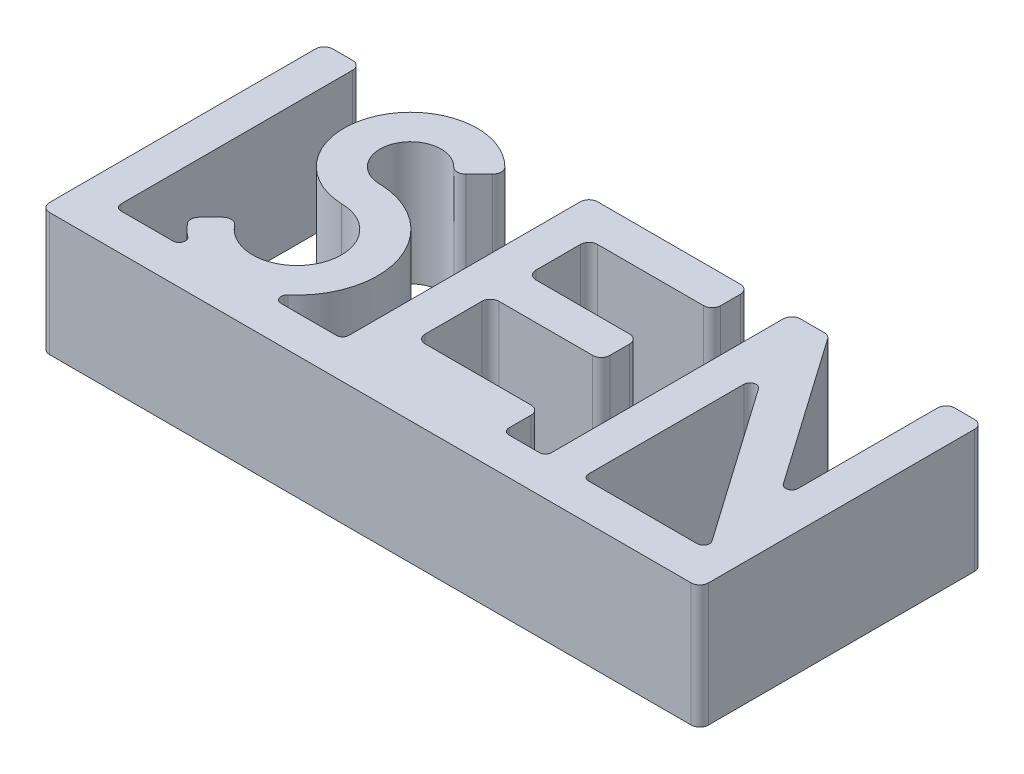
from build123d import *

# Parameters (mm, degrees)
BOSS_EXTRU_1_DEPTH = 10


with BuildPart() as part:
    # Esquisse3 → Boss.-Extru.1 (new body)
    with BuildSketch(Plane(origin=(0, 0, 0), x_dir=(1, 0, 0), z_dir=(0, 1, 0))):
        with BuildLine():
            Line((-82.4, 43.960350299), (-82.4, 24.660350299))
            Line((-82.4, 24.660350299), (-82.4, 22.360350299))
            ThreePointArc((-82.4, 22.360350299), (-82.194974747, 21.865375552), (-81.7, 21.660350299))
            Line((-81.7, 21.660350299), (-29.6, 21.660350299))
            ThreePointArc((-29.6, 21.660350299), (-29.105025253, 21.865375552), (-28.9, 22.360350299))
            Line((-28.9, 22.360350299), (-28.9, 24.660350299))
            Line((-28.9, 24.660350299), (-28.9, 43.960350299))
            ThreePointArc((-28.9, 43.960350299), (-29.105025253, 44.455325045), (-29.6, 44.660350299))
            Line((-29.6, 44.660350299), (-31.2, 44.660350299))
            ThreePointArc((-31.2, 44.660350299), (-31.694974747, 44.455325045), (-31.9, 43.960350299))
            Line((-31.9, 43.960350299), (-31.9, 32.665451753))
            ThreePointArc((-31.9, 32.665451753), (-32.234265531, 32.16295091), (-32.808648392, 32.348220639))
            Line((-32.808648392, 32.348220639), (-41.220684895, 44.361853804))
            ThreePointArc((-41.220684895, 44.361853804), (-41.470867297, 44.581257882), (-41.794091326, 44.660350299))
            Line((-41.794091326, 44.660350299), (-43.729694391, 44.660350299))
            ThreePointArc((-43.729694391, 44.660350299), (-44.224669138, 44.455325045), (-44.429694391, 43.960350299))
            Line((-44.429694391, 43.960350299), (-44.429694391, 25.160350299))
            ThreePointArc((-44.429694391, 25.160350299), (-44.576141, 24.806796908), (-44.929694391, 24.660350299))
            Line((-44.929694391, 24.660350299), (-47.4, 24.660350299))
            ThreePointArc((-47.4, 24.660350299), (-47.753553391, 24.806796908), (-47.9, 25.160350299))
            Line((-47.9, 25.160350299), (-47.9, 26.96406145))
            ThreePointArc((-47.9, 26.96406145), (-48.105025253, 27.459036196), (-48.6, 27.66406145))
            Line((-48.6, 27.66406145), (-57.2, 27.66406145))
            ThreePointArc((-57.2, 27.66406145), (-57.694974747, 27.869086703), (-57.9, 28.36406145))
            Line((-57.9, 28.36406145), (-57.9, 32.960350299))
            ThreePointArc((-57.9, 32.960350299), (-57.694974747, 33.455325045), (-57.2, 33.660350299))
            Line((-57.2, 33.660350299), (-49.6, 33.660350299))
            ThreePointArc((-49.6, 33.660350299), (-49.105025253, 33.865375552), (-48.9, 34.360350299))
            Line((-48.9, 34.360350299), (-48.9, 35.960350299))
            ThreePointArc((-48.9, 35.960350299), (-49.105025253, 36.455325045), (-49.6, 36.660350299))
            Line((-49.6, 36.660350299), (-57.2, 36.660350299))
            ThreePointArc((-57.2, 36.660350299), (-57.694974747, 36.865375552), (-57.9, 37.360350299))
            Line((-57.9, 37.360350299), (-57.9, 40.960350299))
            ThreePointArc((-57.9, 40.960350299), (-57.694974747, 41.455325045), (-57.2, 41.660350299))
            Line((-57.2, 41.660350299), (-48.6, 41.660350299))
            ThreePointArc((-48.6, 41.660350299), (-48.105025253, 41.865375552), (-47.9, 42.360350299))
            Line((-47.9, 42.360350299), (-47.9, 43.960350299))
            ThreePointArc((-47.9, 43.960350299), (-48.105025253, 44.455325045), (-48.6, 44.660350299))
            Line((-48.6, 44.660350299), (-60.2, 44.660350299))
            ThreePointArc((-60.2, 44.660350299), (-60.694974747, 44.455325045), (-60.9, 43.960350299))
            Line((-60.9, 43.960350299), (-60.9, 25.160350299))
            ThreePointArc((-60.9, 25.160350299), (-61.046446609, 24.806796908), (-61.4, 24.660350299))
            Line((-61.4, 24.660350299), (-65.9, 24.660350299))
            ThreePointArc((-65.9, 24.660350299), (-66.369202757, 24.987582324), (-66.224252839, 25.540955207))
            ThreePointArc((-66.224252839, 25.540955207), (-64.278360769, 32.64470583), (-70.174954097, 37.058316142))
            ThreePointArc((-70.174954097, 37.058316142), (-72.565676109, 40.459645131), (-68.487924516, 41.269912109))
            ThreePointArc((-68.487924516, 41.269912109), (-67.991231434, 41.058872606), (-67.492020465, 41.26388504))
            Line((-67.492020465, 41.26388504), (-66.408605494, 42.347300011))
            ThreePointArc((-66.408605494, 42.347300011), (-66.203586079, 42.839415787), (-66.404578845, 43.333189829))
            ThreePointArc((-66.404578845, 43.333189829), (-75.216844977, 41.718134484), (-70.456992958, 34.128124806))
            ThreePointArc((-70.456992958, 34.128124806), (-67.224229351, 28.944517523), (-73.29773035, 28.286390935))
            ThreePointArc((-73.29773035, 28.286390935), (-73.806166505, 28.551332862), (-74.342034946, 28.347503126))
            Line((-74.342034946, 28.347503126), (-75.273738539, 27.415799533))
            ThreePointArc((-75.273738539, 27.415799533), (-75.478062353, 26.95215404), (-75.316017422, 26.472094871))
            ThreePointArc((-75.316017422, 26.472094871), (-74.866763267, 25.988060793), (-74.369432688, 25.55357192))
            ThreePointArc((-74.369432688, 25.55357192), (-74.205711949, 24.996965493), (-74.678263963, 24.660350299))
            Line((-74.678263963, 24.660350299), (-78.9, 24.660350299))
            ThreePointArc((-78.9, 24.660350299), (-79.253553391, 24.806796908), (-79.4, 25.160350299))
            Line((-79.4, 25.160350299), (-79.4, 43.960350299))
            ThreePointArc((-79.4, 43.960350299), (-79.605025253, 44.455325045), (-80.1, 44.660350299))
            Line((-80.1, 44.660350299), (-81.7, 44.660350299))
            ThreePointArc((-81.7, 44.660350299), (-82.194974747, 44.455325045), (-82.4, 43.960350299))
        make_face()
        with BuildLine():
            Line((-41.429694391, 25.160350299), (-41.429694391, 37.760350299))
            ThreePointArc((-41.429694391, 37.760350299), (-41.08004729, 38.237208774), (-40.520118369, 38.047138517))
            Line((-40.520118369, 38.047138517), (-31.697503387, 25.447138517))
            ThreePointArc((-31.697503387, 25.447138517), (-31.663573993, 24.929475992), (-32.107079409, 24.660350299))
            Line((-32.107079409, 24.660350299), (-40.929694391, 24.660350299))
            ThreePointArc((-40.929694391, 24.660350299), (-41.283247781, 24.806796908), (-41.429694391, 25.160350299))
        make_face(mode=Mode.SUBTRACT)
    extrude(amount=BOSS_EXTRU_1_DEPTH)


solid = part.part
